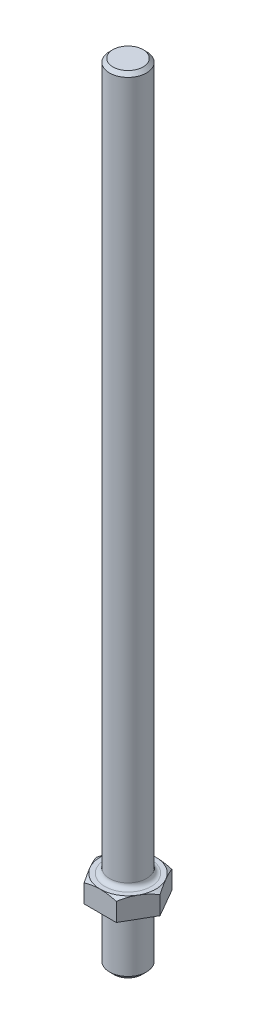
from build123d import *

# Parameters (mm, degrees)
BOSS_EXTRUDE1_DEPTH      = 314
BOSS_EXTRUDE1_DEPTH_BACK = 26
SKETCH1_R                = 8
SKETCH1_3_R              = 8
BOSS_EXTRUDE2_DEPTH      = 9
FILLET1_R                = 2
CHAMFER2_SIZE            = 2
CHAMFER3_SIZE            = 1.5
SKETCH2_OUTSIDE_W        = 129.284
SKETCH2_OUTSIDE_H        = 125.572
SKETCH2_OUTSIDE_R        = 12
CUT_EXTRUDE1_DEPTH       = 9
CUT_EXTRUDE1_DRAFT       = -60


with BuildPart() as part:
    # Sketch1 → Boss-Extrude1 (new, two sides: drawn at the far end of the back side and taken through both)
    with BuildSketch(Plane(origin=(0, 0, 0), x_dir=(1, 0, 0), z_dir=(0, 1, 0)).offset(-BOSS_EXTRUDE1_DEPTH_BACK)):
        Circle(SKETCH1_R)
    extrude(amount=BOSS_EXTRUDE1_DEPTH + BOSS_EXTRUDE1_DEPTH_BACK)

    # Sketch1<3> → Boss-Extrude2 (add)
    with BuildSketch(Plane(origin=(0, 0, 0), x_dir=(1, 0, 0), z_dir=(0, 1, 0))):
        Polygon((13.856406461, 0), (6.92820323, 12), (-6.92820323, 12), (-13.856406461, 0), (-6.92820323, -12), (6.92820323, -12), align=None)
        Circle(SKETCH1_3_R, mode=Mode.SUBTRACT)
    extrude(amount=BOSS_EXTRUDE2_DEPTH)

    # Fillet1
    fillet1_edges = [part.edges().sort_by_distance(p)[0] for p in [
        (-8, 9, 0),
        (-8, 0, 0),
    ]]
    fillet(fillet1_edges, radius=FILLET1_R)

    # Chamfer2
    chamfer2_edges = [part.edges().sort_by_distance(p)[0] for p in [
        (-8, -26, 0),
    ]]
    chamfer(chamfer2_edges, length=CHAMFER2_SIZE)

    # Chamfer3
    chamfer3_edges = [part.edges().sort_by_distance(p)[0] for p in [
        (-8, 314, 0),
    ]]
    chamfer(chamfer3_edges, length=CHAMFER3_SIZE)


with BuildPart() as cut_extrude1_tool:
    # Sketch2 outside → Cut-Extrude1 (with draft: the straight prism first)
    with BuildSketch(Plane(origin=(0, 9, 0), x_dir=(1, 0, 0), z_dir=(0, 1, 0))):
        Rectangle(SKETCH2_OUTSIDE_W, SKETCH2_OUTSIDE_H)
        Circle(SKETCH2_OUTSIDE_R, mode=Mode.SUBTRACT)
    extrude(amount=-CUT_EXTRUDE1_DEPTH)
    # Cut-Extrude1: the draft: its side faces are tilted about the plane it starts from
    cut_extrude1_sides = [cut_extrude1_tool.faces().sort_by_distance(p)[0] for p in [
        (0, 4.5, 62.786),
        (64.642, 4.5, 0),
        (0, 4.5, -62.786),
        (-64.642, 4.5, 0),
        (-12, 4.5, 0),
    ]]
    draft(cut_extrude1_sides, Plane(origin=(0, 9, 0), x_dir=(1, 0, 0), z_dir=(0, 1, 0)), CUT_EXTRUDE1_DRAFT)


with BuildPart() as part_1:
    add(part.part)

    # Cut-Extrude1: cut by cut_extrude1_tool
    add(cut_extrude1_tool.part, mode=Mode.SUBTRACT)


solid = part_1.part
